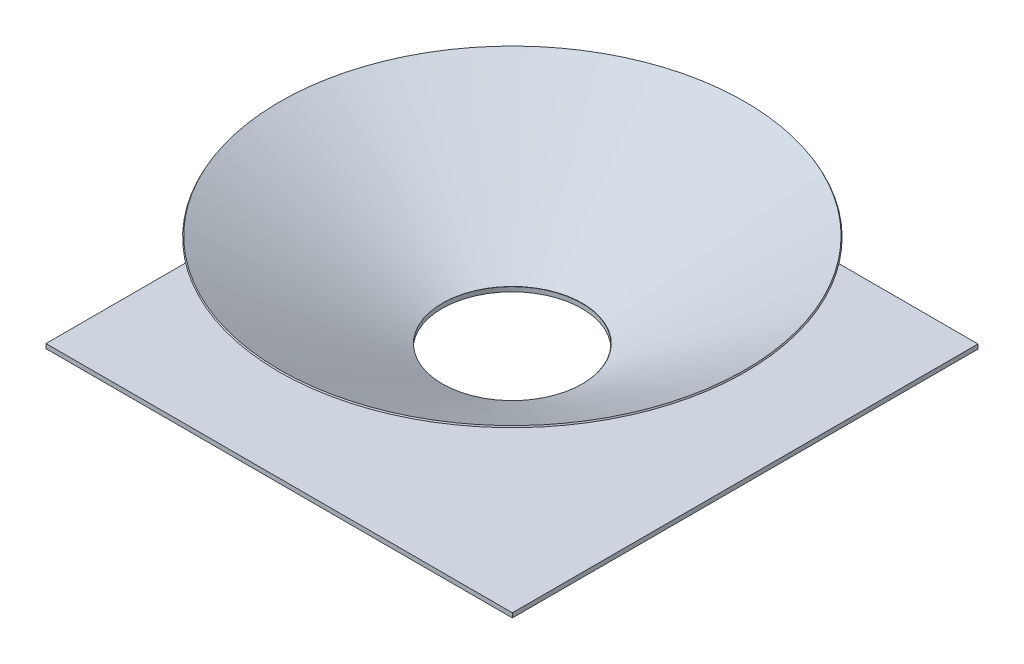
from build123d import *

# Parameters (mm, degrees)
SKETCH2_W           = 312.5
SKETCH2_H           = 312.002153757
SKETCH2_R           = 46.875
BOSS_EXTRUDE1_DEPTH = 3


with BuildPart() as part:
    # Sketch1 → Revolve1 (revolve)
    with BuildSketch(Plane.XY, mode=Mode.PRIVATE) as revolve1_sk:
        Polygon((-48.883652299, 0), (-156.25, 61.63273469), (-155.752153757, 62.5), (-46.875, 0), align=None)
    revolve(revolve1_sk.sketch.rotate(Axis((0, 0, 0), (0, 1, 0)), 90), axis=Axis((0, 0, 0), (0, 1, 0)))


with BuildPart() as body_2:
    # Sketch2 → Boss-Extrude1 (new body)
    with BuildSketch(Plane(origin=(0, 0, 0), x_dir=(1, 0, 0), z_dir=(0, 1, 0))):
        with Locations((0, -0.248923121)):
            Rectangle(SKETCH2_W, SKETCH2_H)
        with Locations(Location((0, -0.248923121, 0), (0, 0, 270))):
            Circle(SKETCH2_R, mode=Mode.SUBTRACT)
    extrude(amount=-BOSS_EXTRUDE1_DEPTH)


solid = Compound([part.part, body_2.part])
